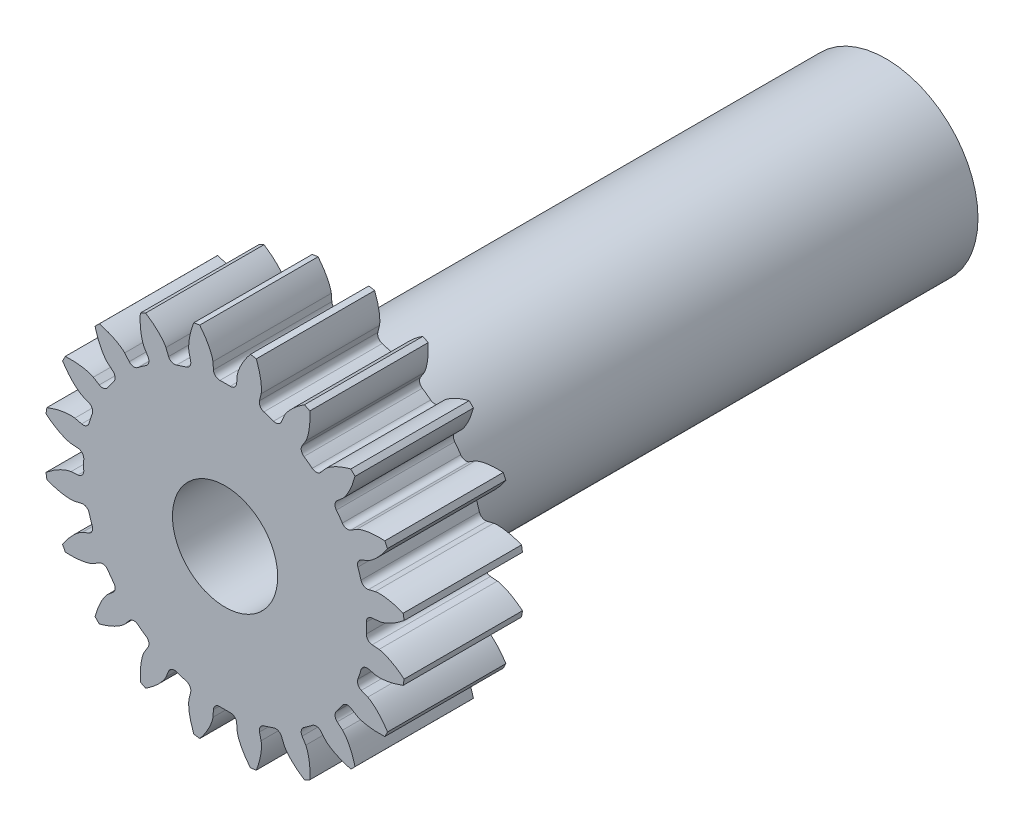
from build123d import *

# Parameters (mm, degrees)
BLANK_SKETCH_R      = 13.75
BLANK_DEPTH         = 9
TOOTH_SPACE_DEPTH   = 22.427202337
TEETH_COUNT         = 20
BORE_DEPTH          = 22.253469727
BORE_DEPTH_BACK     = 22.253469727
BORE_SKETCH_R       = 7
BOSS_EXTRUDE1_START = -50.25
SKETCH1_R           = 7
SKETCH1_R_2         = 4
BOSS_EXTRUDE1_DEPTH = 50.25


with BuildPart() as part:
    # Blank Sketch → Blank (new body)
    with BuildSketch(Plane.XY):
        Circle(BLANK_SKETCH_R)
    extrude(amount=BLANK_DEPTH)

    # Tooth Space Sketch → Tooth Space (cut, symmetric)
    with BuildSketch(Plane.XY):
        with BuildLine():
            Line((11.709860103, 0.922712572), (11.180289267, 0.880983494))
            ThreePointArc((11.180289267, 0.880983494), (10.862988941, 0.723480031), (10.742915644, 0.39020951))
            ThreePointArc((10.742915644, 0.39020951), (10.75, 0), (10.742915644, -0.39020951))
            ThreePointArc((10.742915644, -0.39020951), (10.862988941, -0.723480031), (11.180289267, -0.880983494))
            Line((11.180289267, -0.880983494), (11.709860103, -0.922712572))
            add(Edge.make_bspline(
                [(11.709860103, -0.922712572), (11.715313475, -0.923234617), (11.730580069, -0.924982426), (11.759319753, -0.929405731), (11.80598663, -0.938205714), (11.86506971, -0.951736167), (11.94092317, -0.971871237), (12.029548412, -0.998976801), (12.126085986, -1.032288866), (12.230093072, -1.072304199), (12.332879138, -1.115538905), (12.434437251, -1.161726096), (12.534681177, -1.210479105), (12.654945734, -1.272744636), (12.797491556, -1.351852601), (12.961497116, -1.450701421), (13.144282968, -1.570278326), (13.326873882, -1.699980424), (13.503420438, -1.834000155), (13.677968733, -1.976594979), (13.844122091, -2.119647646), (14.012499078, -2.275384766), (14.16579995, -2.422795632), (14.332640843, -2.595647481), (14.46587003, -2.737409714), (14.599233693, -2.890118061), (14.663505795, -2.96535919), (14.69608147, -3.004195304)],
                knots=[0, 0, 0, 0, 0, 0.005376749, 0.015083688, 0.02853182, 0.046610139, 0.064854849, 0.092110525, 0.119476176, 0.146842496, 0.174208854, 0.201574956, 0.228941013, 0.256307345, 0.307035032, 0.361767352, 0.41649966, 0.471231936, 0.525964282, 0.580696615, 0.635428982, 0.690161387, 0.744893688, 0.799626082, 0.854358408, 0.909090915, 0.909090915, 0.909090915, 0.909090915, 0.909090915], degree=4))
            Line((14.69608147, -3.004195304), (14.69608147, 3.004195304))
            add(Edge.make_bspline(
                [(11.709860103, 0.922712572), (11.715313475, 0.923234617), (11.730580069, 0.924982426), (11.759319753, 0.929405731), (11.80598663, 0.938205714), (11.86506971, 0.951736167), (11.94092317, 0.971871237), (12.029548412, 0.998976801), (12.126085986, 1.032288866), (12.230093072, 1.072304199), (12.332879138, 1.115538905), (12.434437251, 1.161726096), (12.534681177, 1.210479105), (12.654945734, 1.272744636), (12.797491556, 1.351852601), (12.961497116, 1.450701421), (13.144282968, 1.570278326), (13.326873882, 1.699980424), (13.503420438, 1.834000155), (13.677968733, 1.976594979), (13.844122091, 2.119647646), (14.012499078, 2.275384766), (14.16579995, 2.422795632), (14.332640843, 2.595647481), (14.46587003, 2.737409714), (14.599233693, 2.890118061), (14.663505795, 2.96535919), (14.69608147, 3.004195304)],
                knots=[0, 0, 0, 0, 0, 0.005376749, 0.015083688, 0.02853182, 0.046610139, 0.064854849, 0.092110525, 0.119476176, 0.146842496, 0.174208854, 0.201574956, 0.228941013, 0.256307345, 0.307035032, 0.361767352, 0.41649966, 0.471231936, 0.525964282, 0.580696615, 0.635428982, 0.690161387, 0.744893688, 0.799626082, 0.854358408, 0.909090915, 0.909090915, 0.909090915, 0.909090915, 0.909090915], degree=4))
        make_face()
    tooth_space = extrude(amount=TOOTH_SPACE_DEPTH, both=True, mode=Mode.SUBTRACT)

    # Teeth: Tooth Space ×20 about axis
    teeth_axis = Axis((0, 0, -0.25007105), (0, 0, 1))
    for i in range(1, TEETH_COUNT):
        add(tooth_space.rotate(teeth_axis, i * 360 / TEETH_COUNT), mode=Mode.SUBTRACT)

    # Bore Sketch → Bore (cut, two sides: drawn at the far end of the back side and taken through both)
    with BuildSketch(Plane.XY.offset(-BORE_DEPTH_BACK)):
        Circle(BORE_SKETCH_R)
    extrude(amount=BORE_DEPTH + BORE_DEPTH_BACK, mode=Mode.SUBTRACT)

    # Sketch1 → Boss-Extrude1 (add)
    with BuildSketch(Plane.XY.offset(9).offset(BOSS_EXTRUDE1_START)):
        Circle(SKETCH1_R)
        Circle(SKETCH1_R_2, mode=Mode.SUBTRACT)
    extrude(amount=BOSS_EXTRUDE1_DEPTH)


solid = part.part
